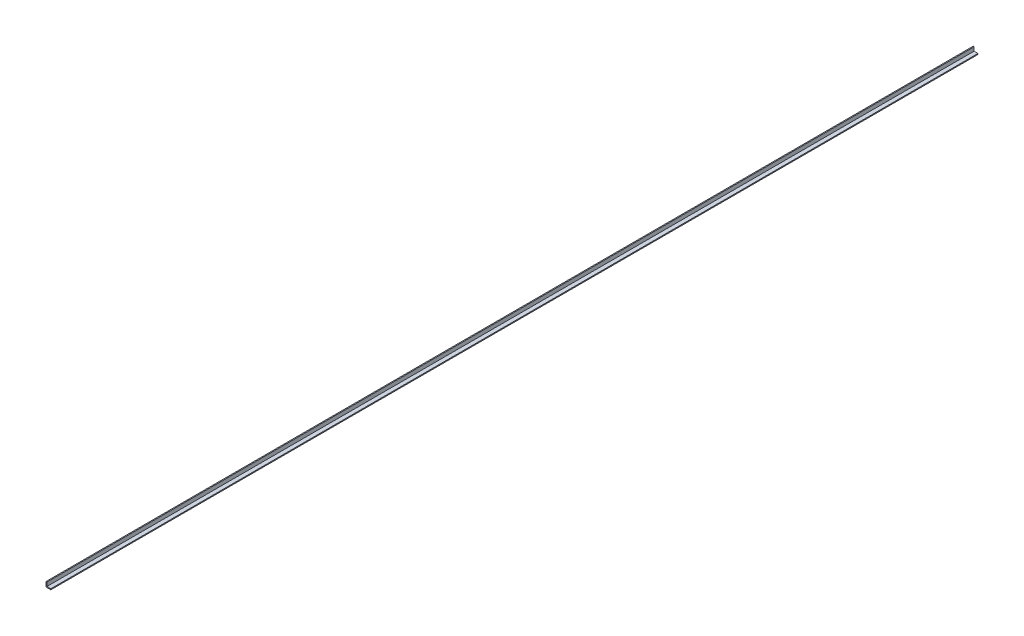
from build123d import *

# Parameters (mm, degrees)
SALIENTE_EXTRUIR1_DEPTH = 6100


with BuildPart() as part:
    # Croquis1 → Saliente-Extruir1 (new body)
    with BuildSketch(Plane.XY):
        Polygon((0, 31.75), (0, 0), (31.75, 0), (31.75, 6.35), (6.35, 6.35), (6.35, 31.75), align=None)
    extrude(amount=-SALIENTE_EXTRUIR1_DEPTH)


solid = part.part
